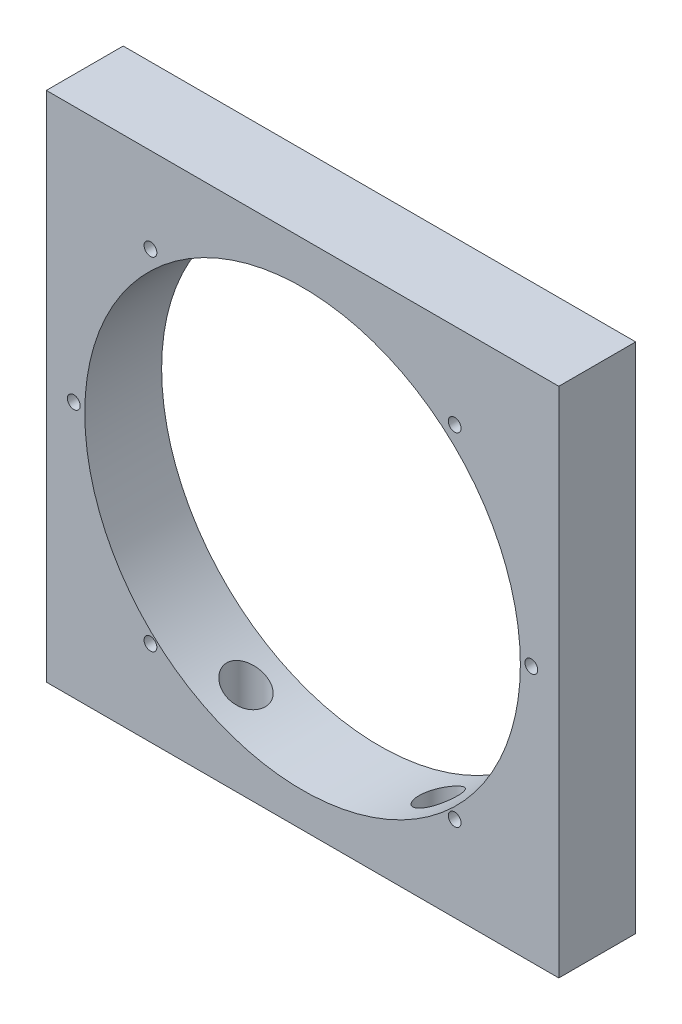
from build123d import *

# Parameters (mm, degrees)
SKETCH1_W           = 40
SKETCH1_H           = 40
BOSS_EXTRUDE1_DEPTH = 3
SKETCH3_R           = 0.5
CUT_EXTRUDE1_DEPTH  = 40
SKETCH4_R           = 1.5
CUT_EXTRUDE3_DEPTH  = 30
SKETCH5_R           = 17
CUT_EXTRUDE7_DEPTH  = 36.186486738


with BuildPart() as part:
    # Sketch1 → Boss-Extrude1 (new, symmetric)
    with BuildSketch(Plane.XY):
        with Locations((0, 8.321173156)):
            Rectangle(SKETCH1_W, SKETCH1_H)
    extrude(amount=BOSS_EXTRUDE1_DEPTH, both=True)

    # Sketch3 → Cut-Extrude1 (cut)
    with BuildSketch(Plane.XY.offset(3)):
        with Locations((-11.872178248, 21.659280154)):
            Circle(SKETCH3_R)
        with Locations((-17.856475427, 8.321173156)):
            Circle(SKETCH3_R)
        with Locations((-11.872178248, -5.016933842)):
            Circle(SKETCH3_R)
        with Locations(Location((11.872178248, -5.016933842, 0), (0, 0, 180))):
            Circle(SKETCH3_R)
        with Locations(Location((17.856475427, 8.321173156, 0), (0, 0, 180))):
            Circle(SKETCH3_R)
        with Locations(Location((11.872178248, 21.659280154, 0), (0, 0, 180))):
            Circle(SKETCH3_R)
    extrude(amount=-CUT_EXTRUDE1_DEPTH, mode=Mode.SUBTRACT)

    # Sketch4 → Cut-Extrude3 (cut)
    with BuildSketch(Plane(origin=(0, 0, 0), x_dir=(1, 0, 0), z_dir=(0, 1, 0))):
        with Locations(Location((-7.5, 0.085145046, 0), (0, 0, 270))):
            Circle(SKETCH4_R)
        with Locations(Location((7.5, 0.085145046, 0), (0, 0, 270))):
            Circle(SKETCH4_R)
    extrude(amount=-CUT_EXTRUDE3_DEPTH, mode=Mode.SUBTRACT)

    # Sketch5 → Cut-Extrude7 (cut, through all)
    with BuildSketch(Plane.XY.offset(3)):
        with Locations((0, 8.01211428)):
            Circle(SKETCH5_R)
    extrude(amount=-CUT_EXTRUDE7_DEPTH, mode=Mode.SUBTRACT)


solid = part.part
